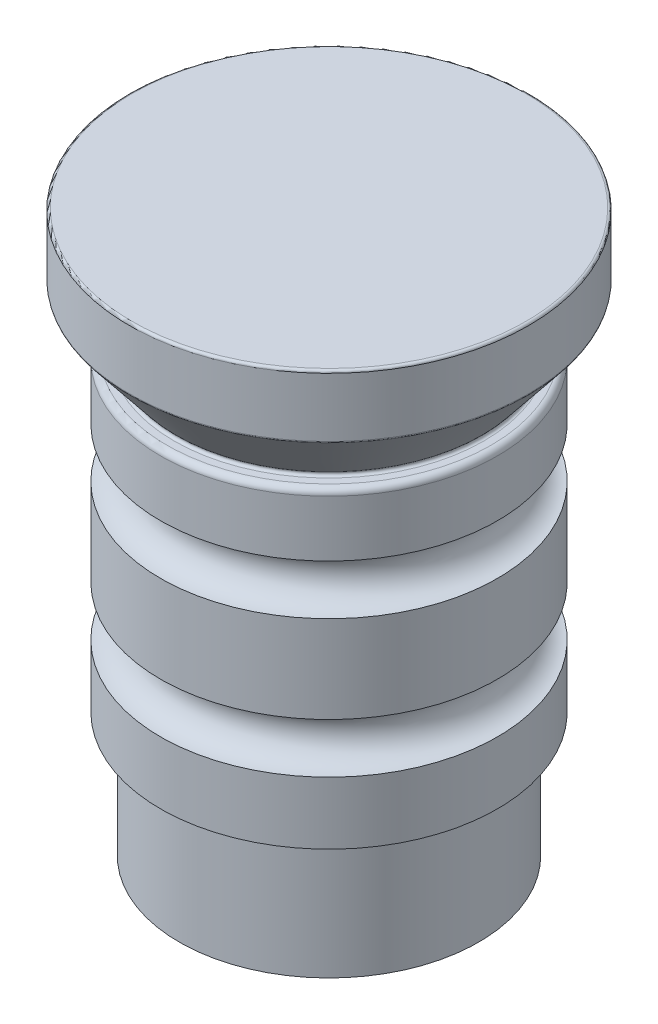
from build123d import *

# Parameters (mm, degrees)
CONG_2_R = 0.5
CONG_3_R = 0.2


with BuildPart() as part:
    # Esquisse1 → Révolution1 (revolve)
    with BuildSketch(Plane.XY):
        with BuildLine():
            Line((0, 4), (-7.5, 4))
            Line((-7.5, 4), (-7.5, 5))
            Line((-7.5, 5), (-10, 5))
            Line((-10, 5), (-10, 0))
            Line((-10, 0), (-12, 0))
            Line((-12, 0), (-12, 10))
            Line((-12, 10), (-13.5, 10))
            Line((-13.5, 10), (-13.5, 15))
            ThreePointArc((-13.5, 15), (-11.5, 17), (-13.5, 19))
            Line((-13.5, 19), (-13.5, 26))
            ThreePointArc((-13.5, 26), (-11.5, 28), (-13.5, 30))
            Line((-13.5, 30), (-13.5, 35))
            Line((-13.5, 35), (-12, 35))
            Line((-12, 35), (-16, 40))
            Line((-16, 40), (-16, 45))
            Line((-16, 45), (0, 45))
            Line((0, 45), (0, 40))
            Line((0, 40), (0, 35))
            Line((0, 35), (0, 4))
        make_face()
    revolve(axis=Axis((0, 35, 0), (0, -1, 0)))

    # Congé2
    cong_2_edges = [part.edges().sort_by_distance(p)[0] for p in [
        (13.5, 35, 0),
    ]]
    fillet(cong_2_edges, radius=CONG_2_R)

    # Congé3
    cong_3_edges = [part.edges().sort_by_distance(p)[0] for p in [
        (16, 45, 0),
        (16, 40, 0),
        (12, 35, 0),
        (10, 5, 0),
        (7.5, 4, 0),
    ]]
    fillet(cong_3_edges, radius=CONG_3_R)


solid = part.part
